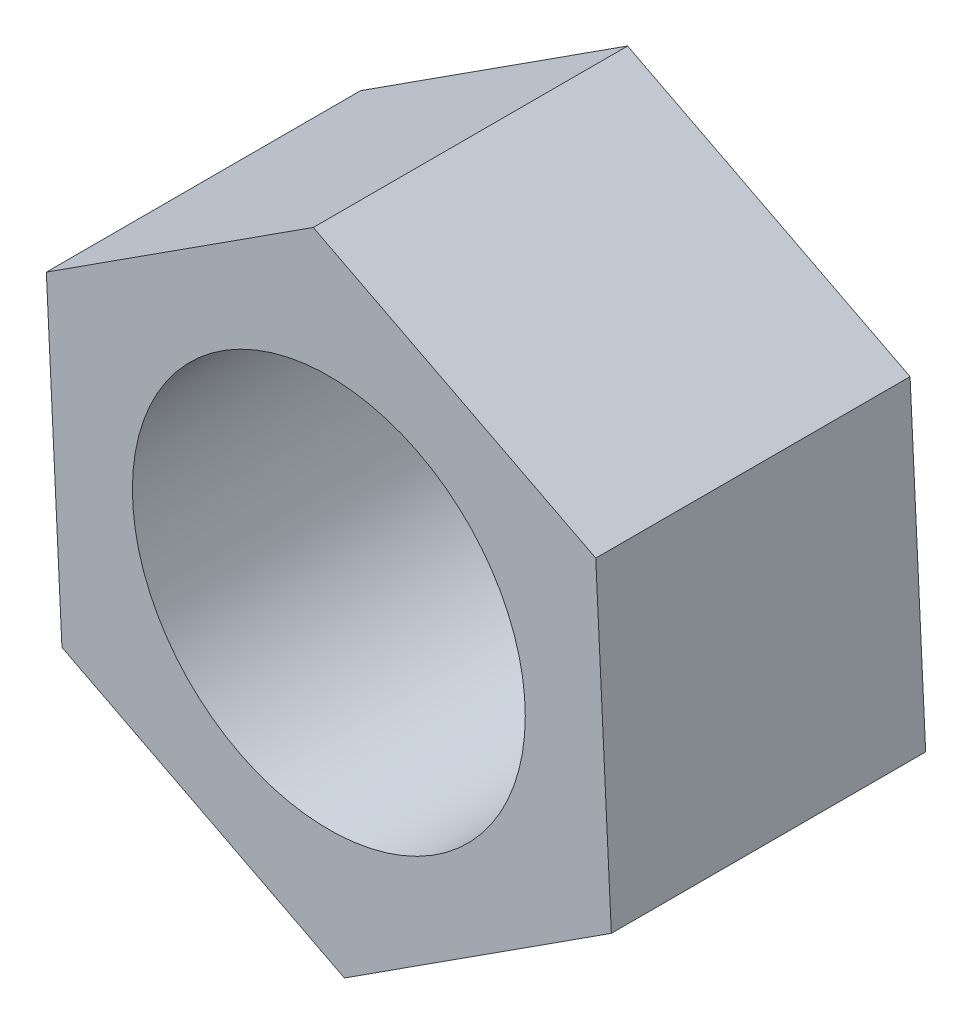
from build123d import *

# Parameters (mm, degrees)
SKETCH1_R           = 2.5
BOSS_EXTRUDE1_DEPTH = 4


with BuildPart() as part:
    # Sketch1 → Boss-Extrude1 (new body)
    with BuildSketch(Plane.XY):
        Polygon((-0.198329202, 4.036582572), (-3.594947653, 1.846533159), (-3.396618451, -2.190049413), (0.198329202, -4.036582572), (3.594947653, -1.846533159), (3.396618451, 2.190049413), align=None)
        Circle(SKETCH1_R, mode=Mode.SUBTRACT)
    extrude(amount=BOSS_EXTRUDE1_DEPTH)


solid = part.part
